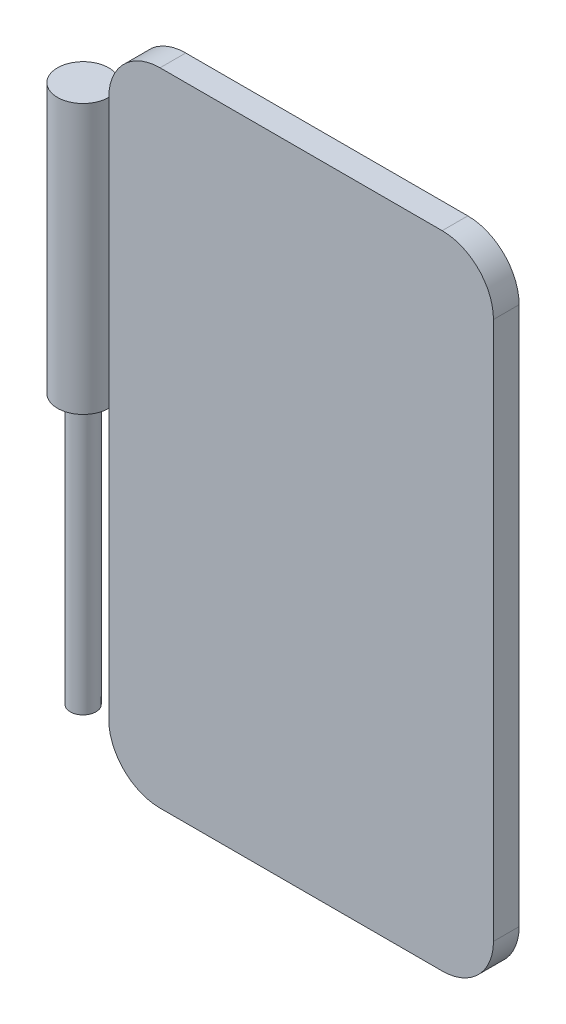
from build123d import *

# Parameters (mm, degrees)
EXTRUDE_1_DEPTH = 0.5
SKETCH_2_W      = 0.5
SKETCH_2_H      = 10.5


with BuildPart() as part:
    # 草图1 → 凸台-拉伸1 (new, symmetric)
    with BuildSketch(Plane.XY):
        with BuildLine():
            Line((17.75, -8.875), (6.75, -8.875))
            ThreePointArc((6.75, -8.875), (5.335786438, -8.289213562), (4.75, -6.875))
            Line((4.75, -6.875), (4.75, 14.125))
            ThreePointArc((4.75, 14.125), (5.335786438, 15.539213562), (6.75, 16.125))
            Line((6.75, 16.125), (17.75, 16.125))
            ThreePointArc((17.75, 16.125), (19.164213562, 15.539213562), (19.75, 14.125))
            Line((19.75, 14.125), (19.75, -6.875))
            ThreePointArc((19.75, -6.875), (19.164213562, -8.289213562), (17.75, -8.875))
        make_face()
    extrude(amount=EXTRUDE_1_DEPTH, both=True)


with BuildPart() as body_2:
    # 草图2 → 旋转1 (revolve)
    with BuildSketch(Plane.XY.offset(0.5), mode=Mode.PRIVATE) as revolve_1_sk:
        Polygon((4.75, 14.125), (3.75, 14.125), (3.75, 3.625), (4.25, 3.625), (4.75, 3.625), align=None)
        with Locations((4, -1.625)):
            Rectangle(SKETCH_2_W, SKETCH_2_H)
    revolve(revolve_1_sk.sketch.rotate(Axis((3.75, 14.125, 0.5), (0, -1, 0)), 180), axis=Axis((3.75, 14.125, 0.5), (0, -1, 0)))


solid = Compound([part.part, body_2.part])
